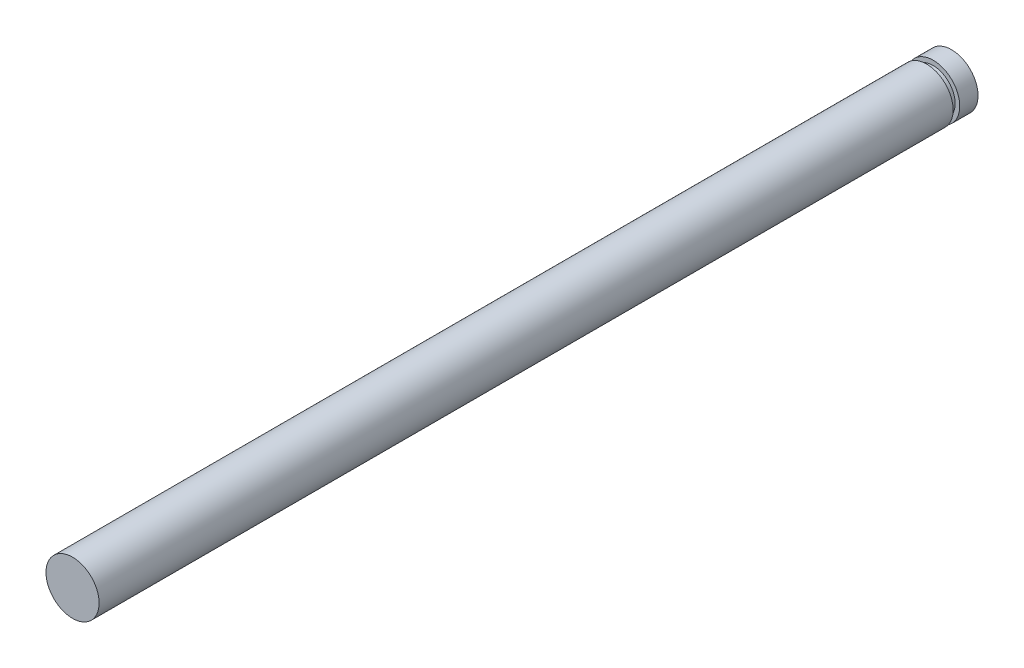
from build123d import *


with BuildPart() as part:
    # Sketch1 → Revolve1 (revolve)
    with BuildSketch(Plane(origin=(0, 0, 0), x_dir=(0, 0, -1), z_dir=(1, 0, 0)), mode=Mode.PRIVATE) as revolve1_sk:
        Polygon((304.8, 0), (304.8, 18.415), (292.1, 18.415), (292.1, 15.24), (287.528, 15.24), (287.528, 18.415), (-304.8, 18.415), (-304.8, 0), align=None)
    revolve(revolve1_sk.sketch.rotate(Axis((0, 0, -126.274285714), (0, 0, 1)), 90), axis=Axis((0, 0, -126.274285714), (0, 0, 1)))


solid = part.part
